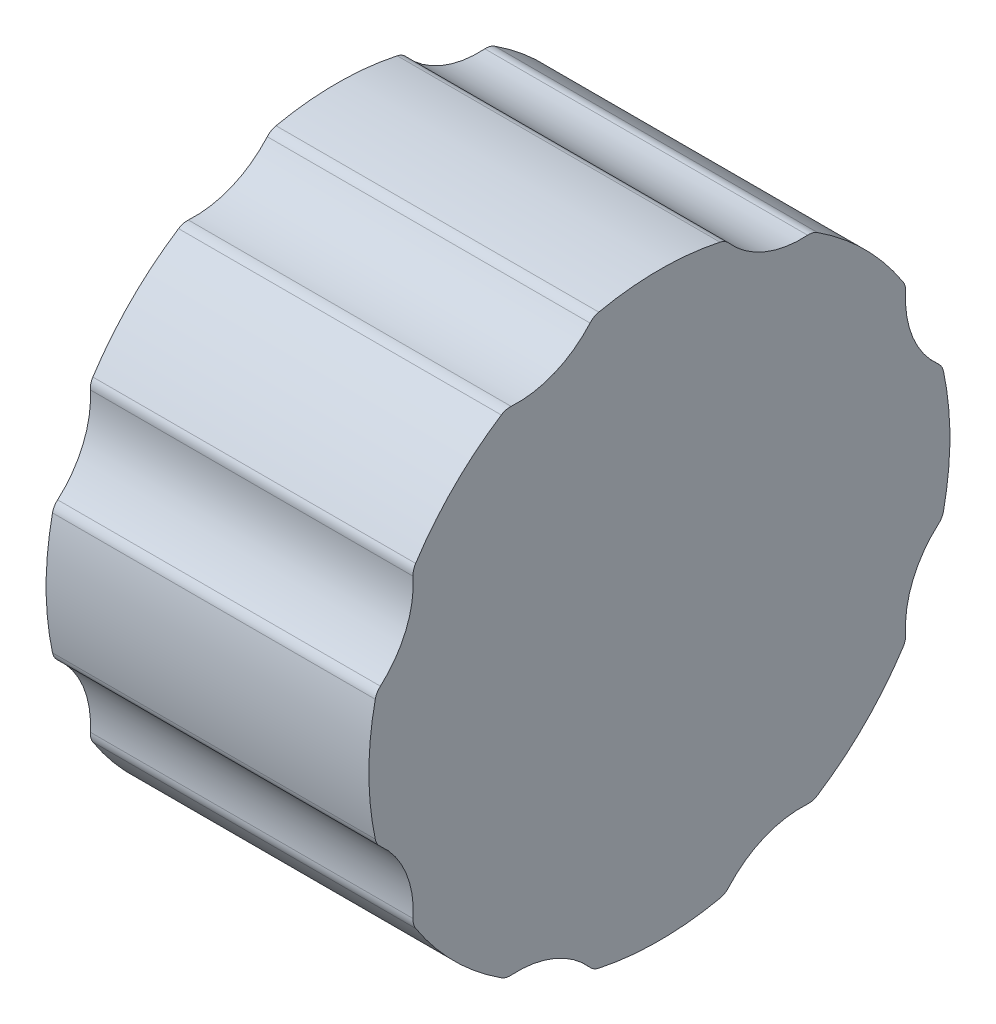
from build123d import *

# Parameters (mm, degrees)
SKETCH1_R           = 9
BOSS_EXTRUDE1_DEPTH = 8
SKETCH2_R           = 9
BOSS_EXTRUDE2_DEPTH = 2
SKETCH3_R           = 3
CUT_EXTRUDE1_DEPTH  = 17.186414056
FILLET3_R           = 0.5
SKETCH4_R           = 1.75
CUT_EXTRUDE2_DEPTH  = 8
SKETCH5_R           = 2
CUT_EXTRUDE3_DEPTH  = 2


with BuildPart() as part:
    # Sketch1 → Boss-Extrude1 (new body)
    with BuildSketch(Plane(origin=(0, 0, 0), x_dir=(0, 0, -1), z_dir=(1, 0, 0))):
        Circle(SKETCH1_R)
        with BuildLine():
            ThreePointArc((1.704, 1.690084022), (0, 2.4), (-1.704, 1.690084022))
            ThreePointArc((-1.704, 1.690084022), (-3, 0), (-1.704, -1.690084022))
            ThreePointArc((-1.704, -1.690084022), (0, -2.4), (1.704, -1.690084022))
            ThreePointArc((1.704, -1.690084022), (3, 0), (1.704, 1.690084022))
        make_face(mode=Mode.SUBTRACT)
    extrude(amount=BOSS_EXTRUDE1_DEPTH)

    # Sketch2 → Boss-Extrude2 (add)
    with BuildSketch(Plane(origin=(8, 0, 0), x_dir=(0, 0, -1), z_dir=(1, 0, 0))):
        Circle(SKETCH2_R)
    extrude(amount=BOSS_EXTRUDE2_DEPTH)

    # Sketch3 → Cut-Extrude1 (cut, through all)
    with BuildSketch(Plane(origin=(10, 0, 0), x_dir=(0, 0, -1), z_dir=(1, 0, 0))):
        with Locations((-4.400859472, 10.624614624)):
            Circle(SKETCH3_R)
        with Locations((4.400859472, 10.624614624)):
            Circle(SKETCH3_R)
        with Locations((10.624614624, 4.400859472)):
            Circle(SKETCH3_R)
        with Locations((4.400859472, -10.624614624)):
            Circle(SKETCH3_R)
        with Locations((-10.624614624, -4.400859472)):
            Circle(SKETCH3_R)
        with Locations((-10.624614624, 4.400859472)):
            Circle(SKETCH3_R)
        with Locations((-4.400859472, -10.624614624)):
            Circle(SKETCH3_R)
        with Locations((10.624614624, -4.400859472)):
            Circle(SKETCH3_R)
    extrude(amount=-CUT_EXTRUDE1_DEPTH, mode=Mode.SUBTRACT)

    # Fillet3
    fillet3_edges = [part.edges().sort_by_distance(p)[0] for p in [
        (5, 8.763991921, 2.047546243),
        (5, 7.64491195, 4.749244284),
        (5, 2.047546243, -8.763991921),
        (5, 4.749244284, -7.64491195),
        (5, -8.763991921, -2.047546243),
        (5, -7.64491195, -4.749244284),
        (5, -2.047546243, 8.763991921),
        (5, -4.749244284, 7.64491195),
        (5, 7.64491195, -4.749244284),
        (5, 8.763991921, -2.047546243),
        (5, 4.749244284, 7.64491195),
        (5, 2.047546243, 8.763991921),
        (5, -7.64491195, 4.749244284),
        (5, -8.763991921, 2.047546243),
        (5, -4.749244284, -7.64491195),
        (5, -2.047546243, -8.763991921),
    ]]
    fillet(fillet3_edges, radius=FILLET3_R)

    # Sketch4 → Cut-Extrude2 (cut)
    with BuildSketch(Plane.ZY):
        with Locations((0, 5.5)):
            Circle(SKETCH4_R)
    extrude(amount=-CUT_EXTRUDE2_DEPTH, mode=Mode.SUBTRACT)

    # Sketch5 → Cut-Extrude3 (cut)
    with BuildSketch(Plane.ZY):
        with Locations((0, 5.5)):
            Circle(SKETCH5_R)
    extrude(amount=-CUT_EXTRUDE3_DEPTH, mode=Mode.SUBTRACT)


solid = part.part
